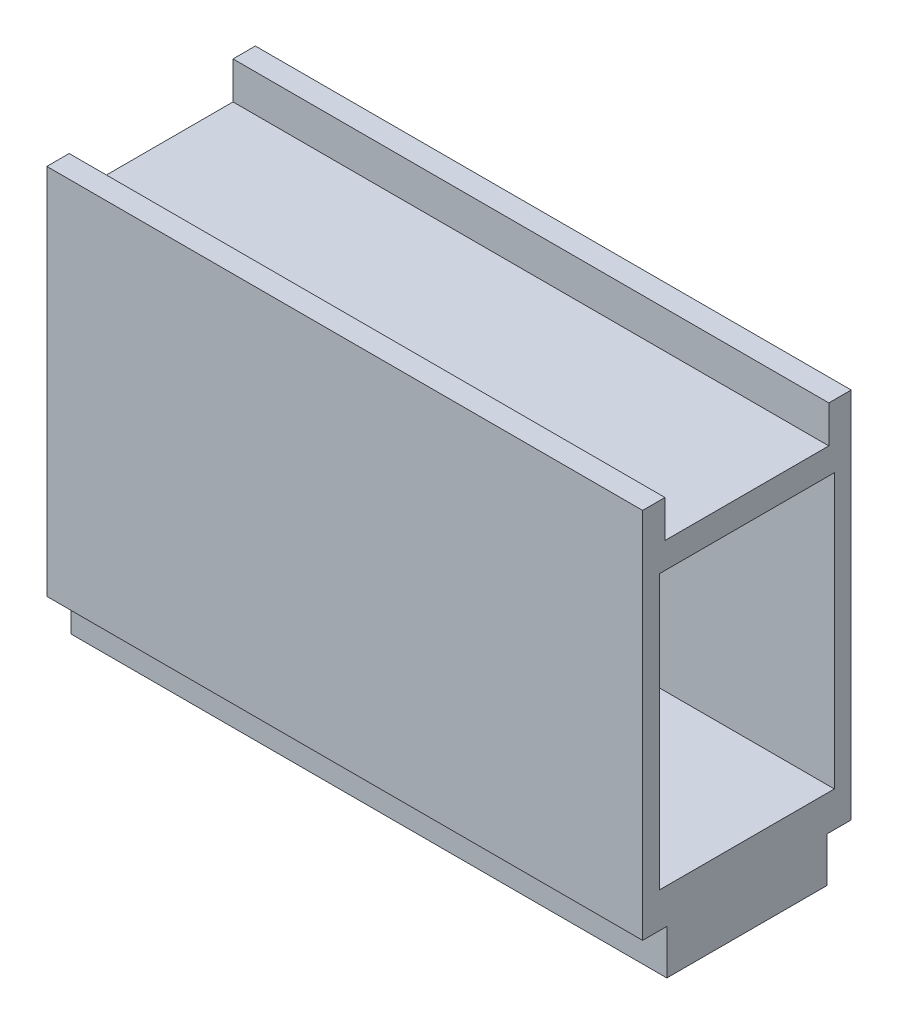
from build123d import *

# Parameters (mm, degrees)
SKETCH1_W           = 80
SKETCH1_H           = 21.5
BOSS_EXTRUDE1_DEPTH = 6
SKETCH2_W           = 80
SKETCH2_H           = 28
BOSS_EXTRUDE2_DEPTH = 50
SKETCH3_W           = 80
SKETCH3_H           = 22
CUT_EXTRUDE1_DEPTH  = 5
CUT_EXTRUDE2_REACH  = 100.651
SKETCH4_W           = 23.48673248
SKETCH4_H           = 36.775278488


with BuildPart() as part:
    # Sketch1 → Boss-Extrude1 (new body)
    with BuildSketch(Plane(origin=(0, 0, 0), x_dir=(1, 0, 0), z_dir=(0, 1, 0))):
        Rectangle(SKETCH1_W, SKETCH1_H)
    extrude(amount=BOSS_EXTRUDE1_DEPTH)

    # Sketch2 → Boss-Extrude2 (add)
    with BuildSketch(Plane(origin=(0, 6, 0), x_dir=(1, 0, 0), z_dir=(0, 1, 0))):
        Rectangle(SKETCH2_W, SKETCH2_H)
    extrude(amount=BOSS_EXTRUDE2_DEPTH)

    # Sketch3 → Cut-Extrude1 (cut)
    with BuildSketch(Plane(origin=(0, 56, 0), x_dir=(1, 0, 0), z_dir=(0, 1, 0))):
        Rectangle(SKETCH3_W, SKETCH3_H)
    extrude(amount=-CUT_EXTRUDE1_DEPTH, mode=Mode.SUBTRACT)

    # Sketch4 → Cut-Extrude2 (cut, up to next)
    with BuildSketch(Plane(origin=(40, 0, 0), x_dir=(0, 0, -1), z_dir=(1, 0, 0)), mode=Mode.PRIVATE) as cut_extrude2_sk1:
        with Locations((0, 29.125130658)):
            Rectangle(SKETCH4_W, SKETCH4_H)
    cut_extrude2_tool1 = extrude(cut_extrude2_sk1.sketch, amount=-CUT_EXTRUDE2_REACH, mode=Mode.PRIVATE) & part.part
    add(cut_extrude2_tool1.solids().sort_by_distance((40, 29.125131, 0))[0], mode=Mode.SUBTRACT)


solid = part.part
